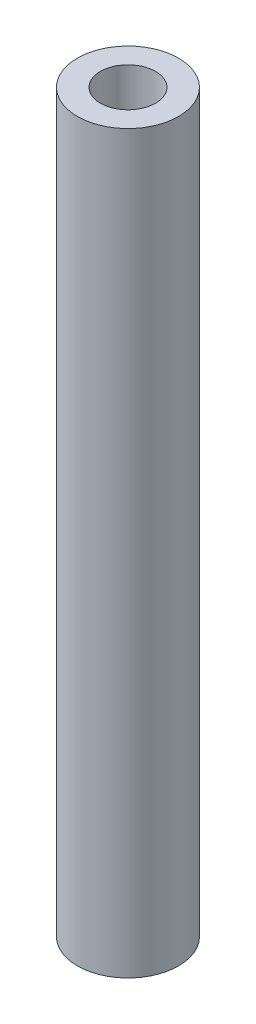
from build123d import *

# Parameters (mm, degrees)
SKETCH1_R           = 2.75
SKETCH1_R_2         = 1.5
BOSS_EXTRUDE1_DEPTH = 40


with BuildPart() as part:
    # Sketch1 → Boss-Extrude1 (new body)
    with BuildSketch(Plane(origin=(0, 0, 0), x_dir=(1, 0, 0), z_dir=(0, 1, 0))):
        with Locations(Location((0, 0, 0), (0, 0, 270))):
            Circle(SKETCH1_R)
        with Locations(Location((0, 0, 0), (0, 0, 270))):
            Circle(SKETCH1_R_2, mode=Mode.SUBTRACT)
    extrude(amount=BOSS_EXTRUDE1_DEPTH)


solid = part.part
